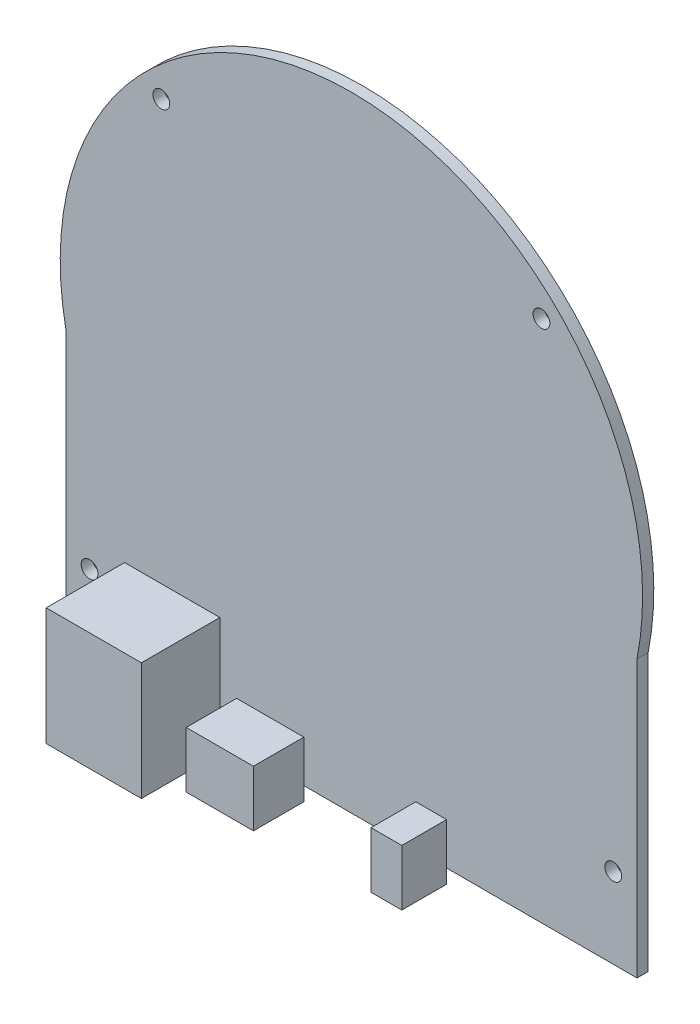
from build123d import *

# Parameters (mm, degrees)
ESQUISSE1_R             = 1.5
BOSS_EXTRU_1_DEPTH      = 2
ESQUISSE2_W             = 17
ESQUISSE2_H             = 14
BOSS_EXTRU_2_DEPTH      = 21
ENL_V_MAT_EXTRU_1_DEPTH = 15
ESQUISSE4_W             = 12
ESQUISSE4_H             = 9
BOSS_EXTRU_3_DEPTH      = 10
ENL_V_MAT_EXTRU_2_DEPTH = 8
ESQUISSE6_R             = 0.375
BOSS_EXTRU_4_DEPTH      = 6
ESQUISSE7_W             = 5.5
ESQUISSE7_H             = 8
BOSS_EXTRU_5_DEPTH      = 10
ESQUISSE8_R             = 2
ENL_V_MAT_EXTRU_3_DEPTH = 8
ESQUISSE9_R             = 0.5
BOSS_EXTRU_6_DEPTH      = 8


with BuildPart() as part:
    # Esquisse1 → Boss.-Extru.1 (new body)
    with BuildSketch(Plane.XY):
        with BuildLine():
            Line((-51, -59.5), (51, -59.5))
            Line((51, -59.5), (51, -10.148891565))
            ThreePointArc((51, -10.148891565), (0, 52), (-51, -10.148891565))
            Line((-51, -10.148891565), (-51, -59.5))
        make_face()
        with Locations((-33.941125497, 33.941125497)):
            Circle(ESQUISSE1_R, mode=Mode.SUBTRACT)
        with Locations((-46.757087022, -45.15279408)):
            Circle(ESQUISSE1_R, mode=Mode.SUBTRACT)
        with Locations(Location((33.941125497, 33.941125497, 0), (0, 0, 180))):
            Circle(ESQUISSE1_R, mode=Mode.SUBTRACT)
        with Locations(Location((46.757087022, -45.15279408, 0), (0, 0, 180))):
            Circle(ESQUISSE1_R, mode=Mode.SUBTRACT)
    extrude(amount=BOSS_EXTRU_1_DEPTH)


with BuildPart() as body_2:
    # Esquisse2 → Boss.-Extru.2 (new body)
    with BuildSketch(Plane.XZ.offset(61.5)):
        with Locations((-31.5, 9.5)):
            Rectangle(ESQUISSE2_W, ESQUISSE2_H)
    extrude(amount=-BOSS_EXTRU_2_DEPTH)

    # Esquisse3 → Enlèv. mat.-Extru.1 (cut)
    with BuildSketch(Plane.XZ.offset(61.5)):
        Polygon((-39, 14.5), (-24, 14.5), (-24, 6), (-28.5, 6), (-28.5, 4.5), (-29.5, 4.5), (-29.5, 3.5), (-33.5, 3.5), (-33.5, 4.5), (-34.5, 4.5), (-34.5, 6), (-39, 6), align=None)
    extrude(amount=-ENL_V_MAT_EXTRU_1_DEPTH, mode=Mode.SUBTRACT)


with BuildPart() as body_3:
    # Esquisse4 → Boss.-Extru.3 (new body)
    with BuildSketch(Plane.XZ.offset(61.5)):
        with Locations((-14, 7)):
            Rectangle(ESQUISSE4_W, ESQUISSE4_H)
    extrude(amount=-BOSS_EXTRU_3_DEPTH)

    # Esquisse5 → Enlèv. mat.-Extru.2 (cut)
    with BuildSketch(Plane.XZ.offset(61.5)):
        Polygon((-19.5, 3), (-8.5, 3), (-8.5, 10), (-9, 10), (-9, 10.25), (-8.5, 10.25), (-8.5, 11), (-10.5, 11), (-10.5, 10.25), (-10, 10.25), (-10, 10), (-10.75, 10), (-11.25, 10), (-11.25, 10.25), (-10.75, 10.25), (-10.75, 11), (-12.75, 11), (-12.75, 10.25), (-12.25, 10.25), (-12.25, 10), (-13, 10), (-13.5, 10), (-13.5, 10.25), (-13, 10.25), (-13, 11), (-15, 11), (-15, 10.25), (-14.5, 10.25), (-14.5, 10), (-15.25, 10), (-15.75, 10), (-15.75, 10.25), (-15.25, 10.25), (-15.25, 11), (-17.25, 11), (-17.25, 10.25), (-16.75, 10.25), (-16.75, 10), (-17.5, 10), (-18, 10), (-18, 10.25), (-17.5, 10.25), (-17.5, 11), (-19.5, 11), (-19.5, 10.25), (-19, 10.25), (-19, 10), (-19.5, 10), align=None)
    extrude(amount=-ENL_V_MAT_EXTRU_2_DEPTH, mode=Mode.SUBTRACT)

    # Esquisse6 → Boss.-Extru.4 (add)
    with BuildSketch(Plane.XZ.offset(53.5)):
        with Locations(Location((-18.54781029, 6.618225755, 0), (0, 0, 270))):
            Circle(ESQUISSE6_R)
        with Locations(Location((-16.29781029, 6.618225755, 0), (0, 0, 270))):
            Circle(ESQUISSE6_R)
        with Locations(Location((-14.04781029, 6.618225755, 0), (0, 0, 270))):
            Circle(ESQUISSE6_R)
        with Locations(Location((-11.79781029, 6.618225755, 0), (0, 0, 270))):
            Circle(ESQUISSE6_R)
        with Locations(Location((-9.54781029, 6.618225755, 0), (0, 0, 270))):
            Circle(ESQUISSE6_R)
    extrude(amount=BOSS_EXTRU_4_DEPTH)


with BuildPart() as body_4:
    # Esquisse7 → Boss.-Extru.5 (new body)
    with BuildSketch(Plane.XZ.offset(61.5)):
        with Locations((14.75, 6.5)):
            Rectangle(ESQUISSE7_W, ESQUISSE7_H)
    extrude(amount=-BOSS_EXTRU_5_DEPTH)

    # Esquisse8 → Enlèv. mat.-Extru.3 (cut)
    with BuildSketch(Plane.XZ.offset(61.5)):
        with Locations(Location((14.75, 6.977178827, 0), (0, 0, 270))):
            Circle(ESQUISSE8_R)
    extrude(amount=-ENL_V_MAT_EXTRU_3_DEPTH, mode=Mode.SUBTRACT)

    # Esquisse9 → Boss.-Extru.6 (add)
    with BuildSketch(Plane.XZ.offset(53.5)):
        with Locations(Location((14.75, 6.977178827, 0), (0, 0, 270))):
            Circle(ESQUISSE9_R)
    extrude(amount=BOSS_EXTRU_6_DEPTH)


solid = Compound([part.part, body_2.part, body_3.part, body_4.part])
